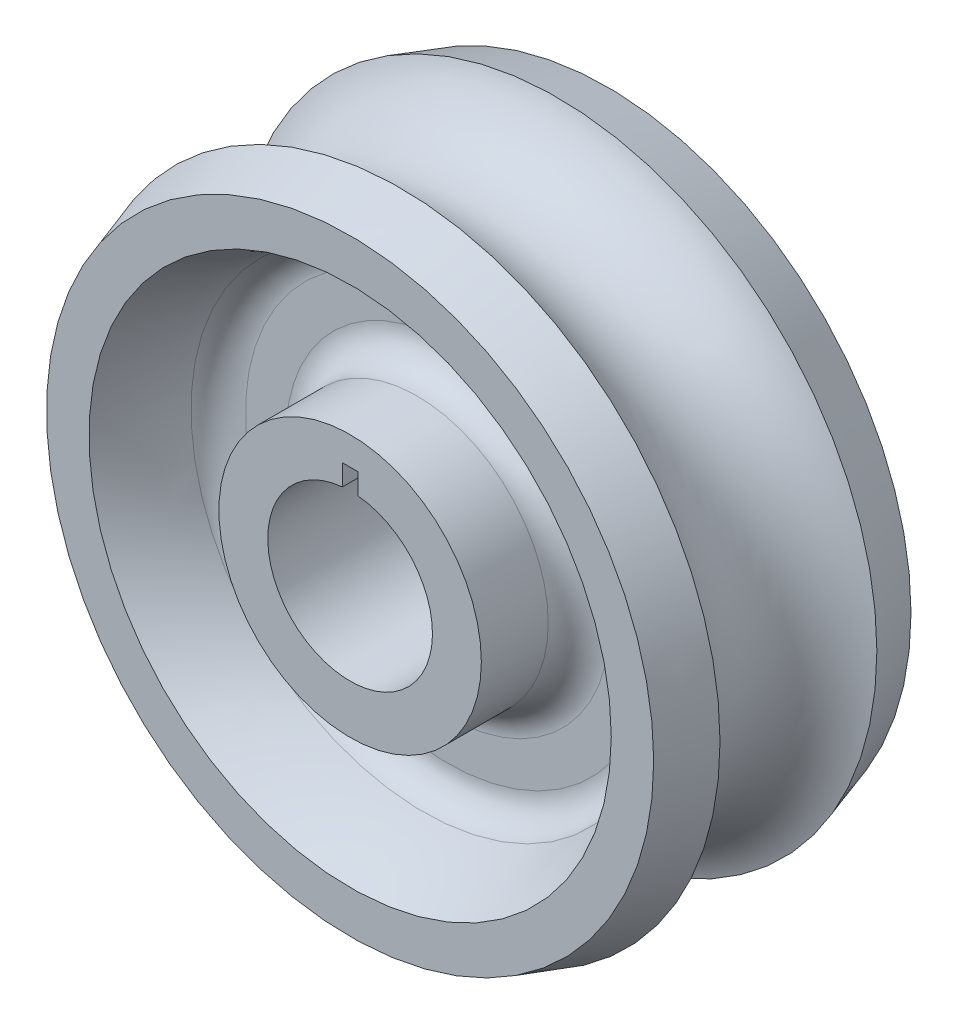
from build123d import *

# Parameters (mm, degrees)
CUT_EXTRUDE1_DEPTH = 51.543744576


with BuildPart() as part:
    # Sketch1 → Base-Revolve (revolve)
    with BuildSketch(Plane(origin=(0, 0, 0), x_dir=(0, 0, -1), z_dir=(1, 0, 0)), mode=Mode.PRIVATE) as base_revolve_sk:
        with BuildLine():
            Line((-12.5, 8), (12.5, 8))
            Line((12.5, 8), (12.5, 12.75))
            Line((12.5, 12.75), (6, 12.75))
            ThreePointArc((6, 12.75), (3.878679656, 13.628679656), (3, 15.75))
            Line((3, 15.75), (3, 19.676046432))
            ThreePointArc((3, 19.676046432), (3.662418833, 21.556395944), (5.357142857, 22.606359503))
            ThreePointArc((5.357142857, 22.606359503), (9.035249322, 23.715459855), (12.5, 25.375))
            Line((12.5, 25.375), (12.5, 29.5))
            Line((12.5, 29.5), (7.619393178, 31.061794183))
            ThreePointArc((7.619393178, 31.061794183), (0, 25.5), (-7.619393178, 31.061794183))
            Line((-7.619393178, 31.061794183), (-12.5, 29.5))
            Line((-12.5, 29.5), (-12.5, 25.375))
            ThreePointArc((-12.5, 25.375), (-9.035249322, 23.715459855), (-5.357142857, 22.606359503))
            ThreePointArc((-5.357142857, 22.606359503), (-3.662418833, 21.556395944), (-3, 19.676046432))
            Line((-3, 19.676046432), (-3, 15.75))
            ThreePointArc((-3, 15.75), (-3.878679656, 13.628679656), (-6, 12.75))
            Line((-6, 12.75), (-12.5, 12.75))
            Line((-12.5, 12.75), (-12.5, 8))
        make_face()
    revolve(base_revolve_sk.sketch.rotate(Axis((0, 0, 0), (0, 0, -1)), 90), axis=Axis((0, 0, 0), (0, 0, -1)))

    # Sketch2 → Cut-Extrude1 (cut, through all)
    with BuildSketch(Plane.XY.offset(12.5)):
        with BuildLine():
            Line((-0.75, 7.964766161), (-0.75, 10))
            Line((-0.75, 10), (0.75, 10))
            Line((0.75, 10), (0.75, 7.964766161))
            ThreePointArc((0.75, 7.964766161), (0, 8), (-0.75, 7.964766161))
        make_face()
    extrude(amount=-CUT_EXTRUDE1_DEPTH, mode=Mode.SUBTRACT)


solid = part.part
